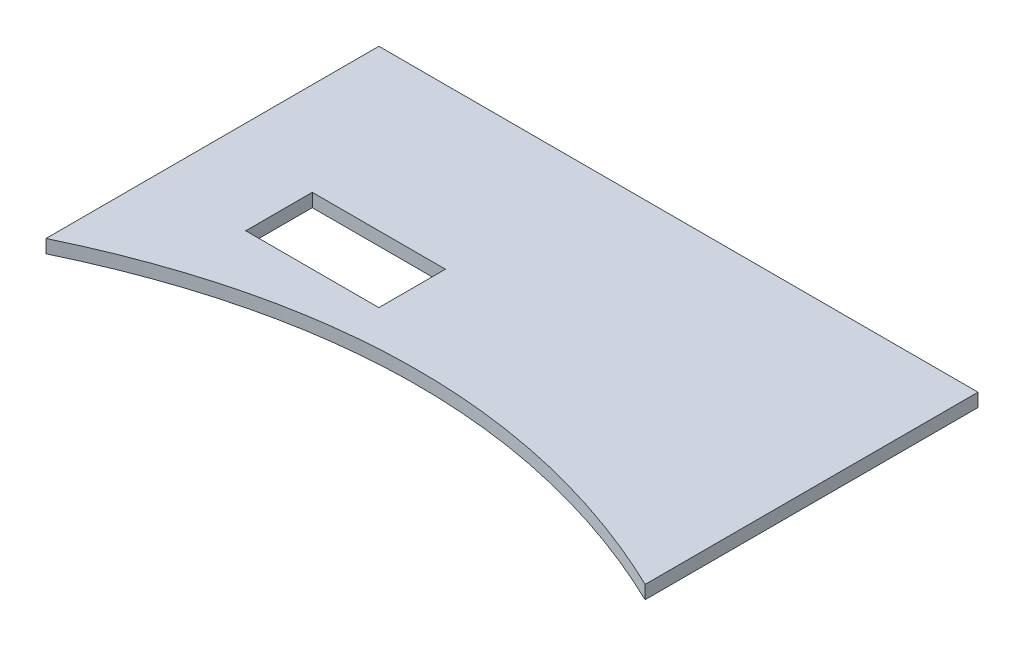
from build123d import *

# Parameters (mm, degrees)
BOSS_EXTRUDE1_DEPTH = 1
SKETCH2_W           = 10
SKETCH2_H           = 5
CUT_EXTRUDE1_DEPTH  = 1


with BuildPart() as part:
    # Sketch1 → Boss-Extrude1 (new body)
    with BuildSketch(Plane(origin=(0, 0, 0), x_dir=(1, 0, 0), z_dir=(0, 1, 0))):
        with BuildLine():
            Line((-22.5, -12.500000317), (-22.5, 12.500000317))
            Line((-22.5, 12.500000317), (22.5, 12.500000317))
            Line((22.5, 12.500000317), (22.5, -12.499999683))
            add(Edge.make_bspline(
                [(-22.5, -12.500000317), (-22.439792168, -12.471062497), (-21.720318389, -12.126671398), (-20.033278548, -11.358209685), (-16.487166751, -9.929593391), (-11.649258831, -8.428412522), (-5.831090838, -7.344665325), (-7.7e-08, -6.981224033), (5.831090693, -7.344665161), (11.649258717, -8.428412194), (16.487166679, -9.929592927), (20.033278516, -11.358209122), (21.720318379, -12.126670787), (22.439792167, -12.471061866), (22.5, -12.499999683)],
                knots=[0.029712498, 0.029712498, 0.029712498, 0.029712498, 0.033515652, 0.075187399, 0.135874913, 0.257249942, 0.378624971, 0.5, 0.621375029, 0.742750058, 0.864125087, 0.924812601, 0.966484348, 0.970287502, 0.970287502, 0.970287502, 0.970287502], degree=3))
        make_face()
    extrude(amount=BOSS_EXTRUDE1_DEPTH)

    # Sketch2 → Cut-Extrude1 (cut)
    with BuildSketch(Plane(origin=(0, 1, 0), x_dir=(1, 0, 0), z_dir=(0, 1, 0))):
        with Locations((-10.5, -1.999999683)):
            Rectangle(SKETCH2_W, SKETCH2_H)
    extrude(amount=-CUT_EXTRUDE1_DEPTH, mode=Mode.SUBTRACT)


solid = part.part
